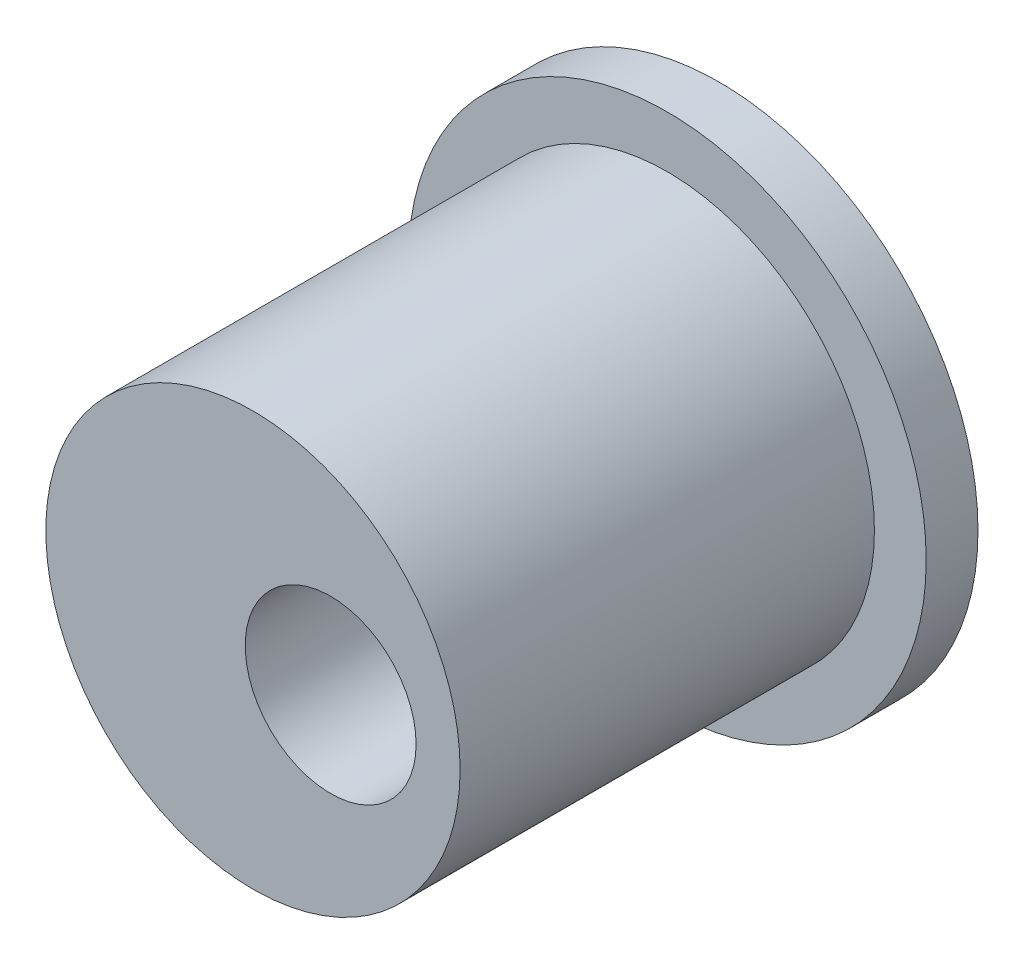
from build123d import *

# Parameters (mm, degrees)
ESQUISSE1_R             = 5
BOSS_EXTRU_1_DEPTH      = 1
ESQUISSE2_R             = 4
BOSS_EXTRU_2_DEPTH      = 8
ESQUISSE3_R             = 1.65
ENL_V_MAT_EXTRU_1_DEPTH = 7


with BuildPart() as part:
    # Esquisse1 → Boss.-Extru.1 (new body)
    with BuildSketch(Plane.XY):
        Circle(ESQUISSE1_R)
    extrude(amount=BOSS_EXTRU_1_DEPTH)

    # Esquisse2 → Boss.-Extru.2 (add)
    with BuildSketch(Plane.XY.offset(1)):
        Circle(ESQUISSE2_R)
    extrude(amount=BOSS_EXTRU_2_DEPTH)

    # Esquisse3 → Enlèv. mat.-Extru.1 (cut)
    with BuildSketch(Plane.XY.offset(9)):
        with Locations((1.5, 0)):
            Circle(ESQUISSE3_R)
    extrude(amount=-ENL_V_MAT_EXTRU_1_DEPTH, mode=Mode.SUBTRACT)


solid = part.part
